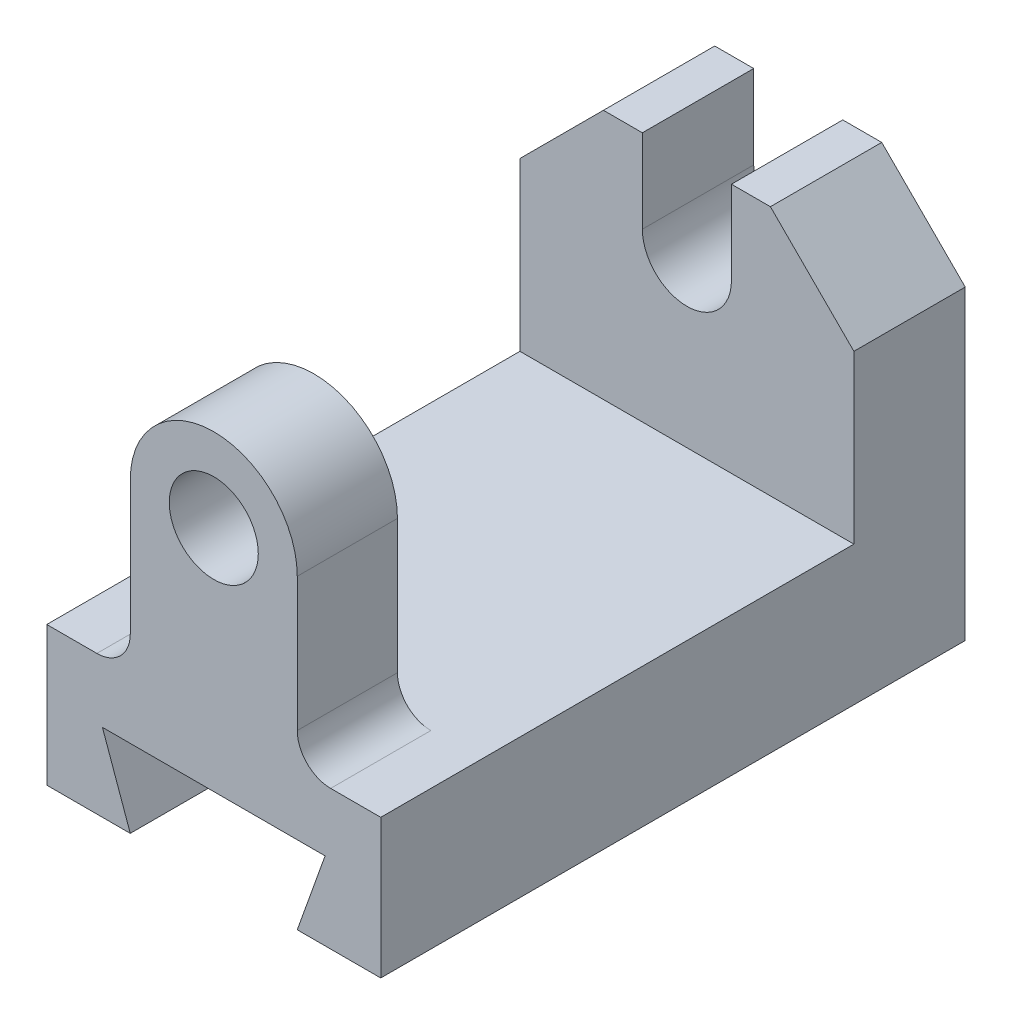
from build123d import *

# Parameters (mm, degrees)
BOSS_EXTRUDE1_DEPTH = 105
SKETCH2_R           = 8
BOSS_EXTRUDE2_DEPTH = 18
FILLET1_R           = 6
BOSS_EXTRUDE3_START = -20
BOSS_EXTRUDE3_DEPTH = 20


with BuildPart() as part:
    # Sketch1 → Boss-Extrude1 (new body)
    with BuildSketch(Plane.XY):
        Polygon((45, 0), (60, 0), (60, 25), (0, 25), (0, 0), (15, 0), (10, 14), (50, 14), align=None)
    extrude(amount=-BOSS_EXTRUDE1_DEPTH)

    # Sketch2 → Boss-Extrude2 (add)
    with BuildSketch(Plane.XY):
        with BuildLine():
            Line((15, 55), (15, 25))
            Line((15, 25), (45, 25))
            Line((45, 25), (45, 55))
            ThreePointArc((45, 55), (30, 70), (15, 55))
        make_face()
        with Locations((30, 55)):
            Circle(SKETCH2_R, mode=Mode.SUBTRACT)
    extrude(amount=-BOSS_EXTRUDE2_DEPTH)

    # Fillet1
    fillet1_edges = [part.edges().sort_by_distance(p)[0] for p in [
        (45, 25, -9),
        (15, 25, -9),
    ]]
    fillet(fillet1_edges, radius=FILLET1_R)

    # Sketch3 → Boss-Extrude3 (add)
    with BuildSketch(Plane(origin=(0, 0, -105), x_dir=(-1, 0, 0), z_dir=(0, 0, -1)).offset(BOSS_EXTRUDE3_START)):
        with BuildLine():
            Line((-60, 55), (-45, 70))
            Line((-45, 70), (-38, 70))
            Line((-38, 70), (-38, 55))
            ThreePointArc((-38, 55), (-30, 47), (-22, 55))
            Line((-22, 55), (-22, 70))
            Line((-22, 70), (-15, 70))
            Line((-15, 70), (0, 55))
            Line((0, 55), (0, 25))
            Line((0, 25), (-60, 25))
            Line((-60, 25), (-60, 55))
        make_face()
    extrude(amount=BOSS_EXTRUDE3_DEPTH)


solid = part.part
